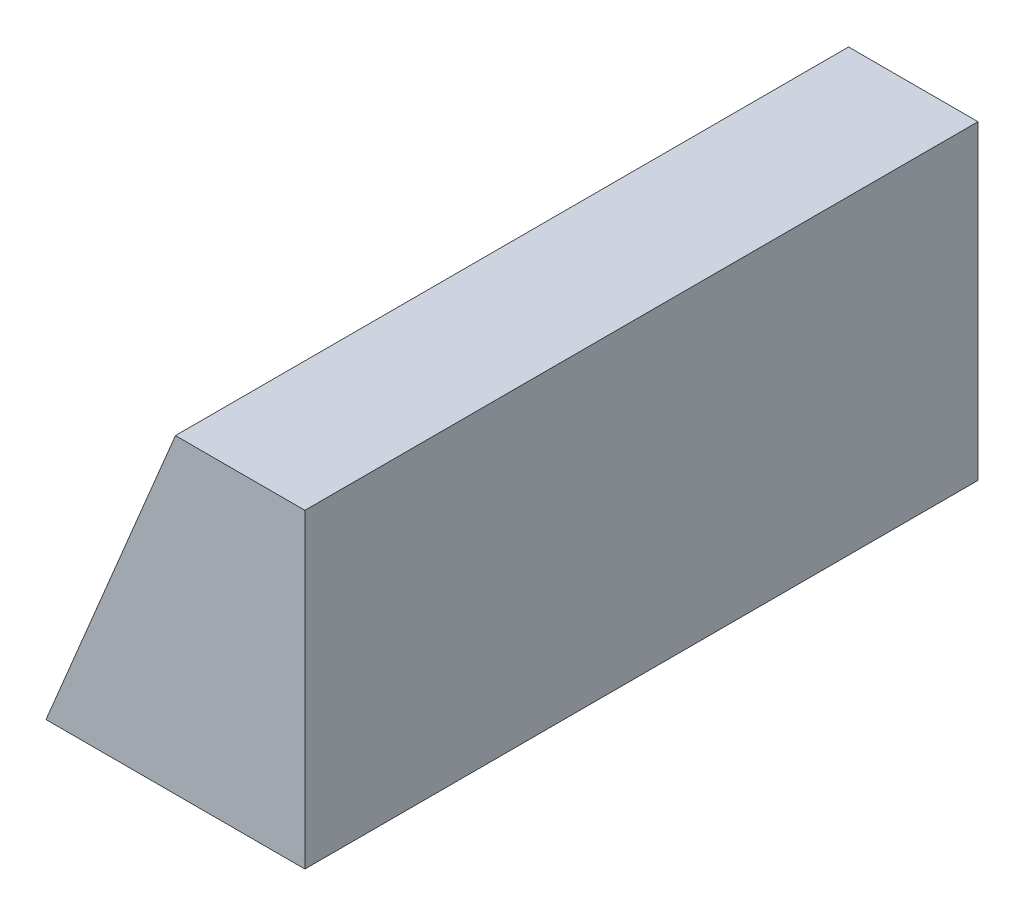
from build123d import *

# Parameters (mm, degrees)
BOSS_EXTRUDE1_DEPTH = 26


with BuildPart() as part:
    # Sketch1 → Boss-Extrude1 (new body)
    with BuildSketch(Plane.XY):
        Polygon((-4.071016037, -1.929460581), (5.928983963, -1.929460581), (5.928983963, 10.070539419), (0.928983963, 10.070539419), align=None)
    extrude(amount=BOSS_EXTRUDE1_DEPTH)


solid = part.part
